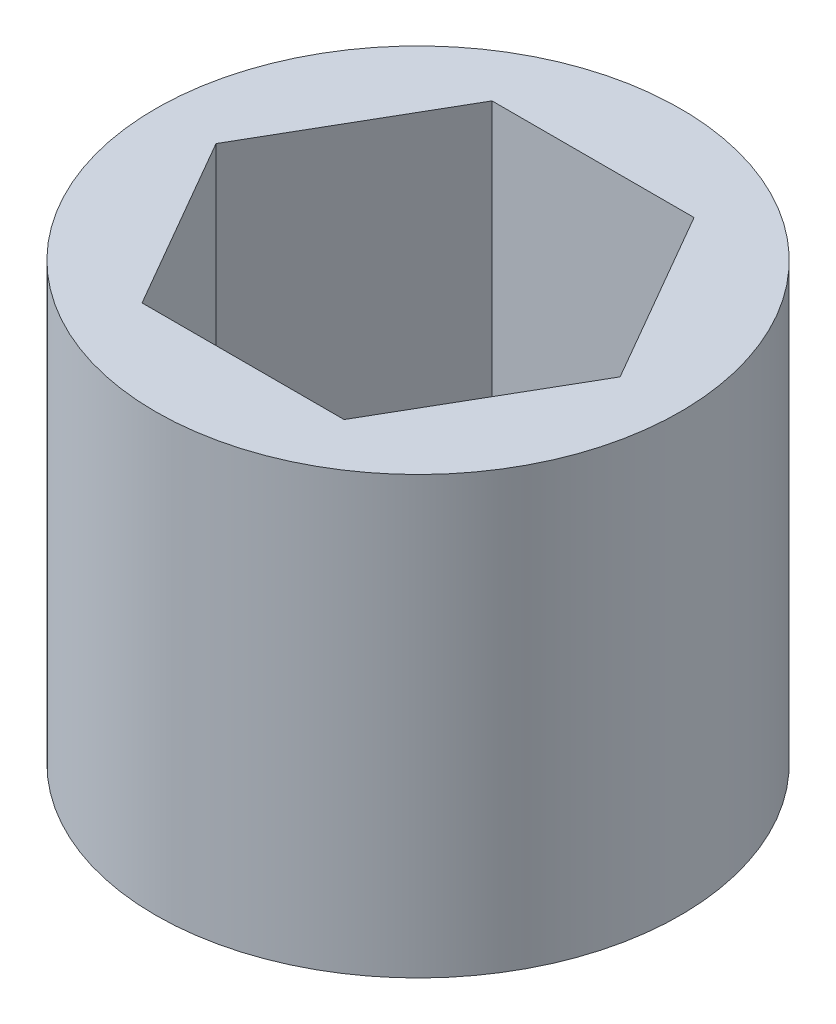
from build123d import *

# Parameters (mm, degrees)
SKETCH1_R           = 9.525
BOSS_EXTRUDE1_DEPTH = 15.8242


with BuildPart() as part:
    # Sketch1 → Boss-Extrude1 (new body)
    with BuildSketch(Plane(origin=(0, 0, 0), x_dir=(1, 0, 0), z_dir=(0, 1, 0))):
        with Locations(Location((0, 0, 0), (0, 0, 270))):
            Circle(SKETCH1_R)
        Polygon((7.332348419, 0), (3.666174209, 6.35), (-3.666174209, 6.35), (-7.332348419, 0), (-3.666174209, -6.35), (3.666174209, -6.35), align=None, mode=Mode.SUBTRACT)
    extrude(amount=BOSS_EXTRUDE1_DEPTH)


solid = part.part
